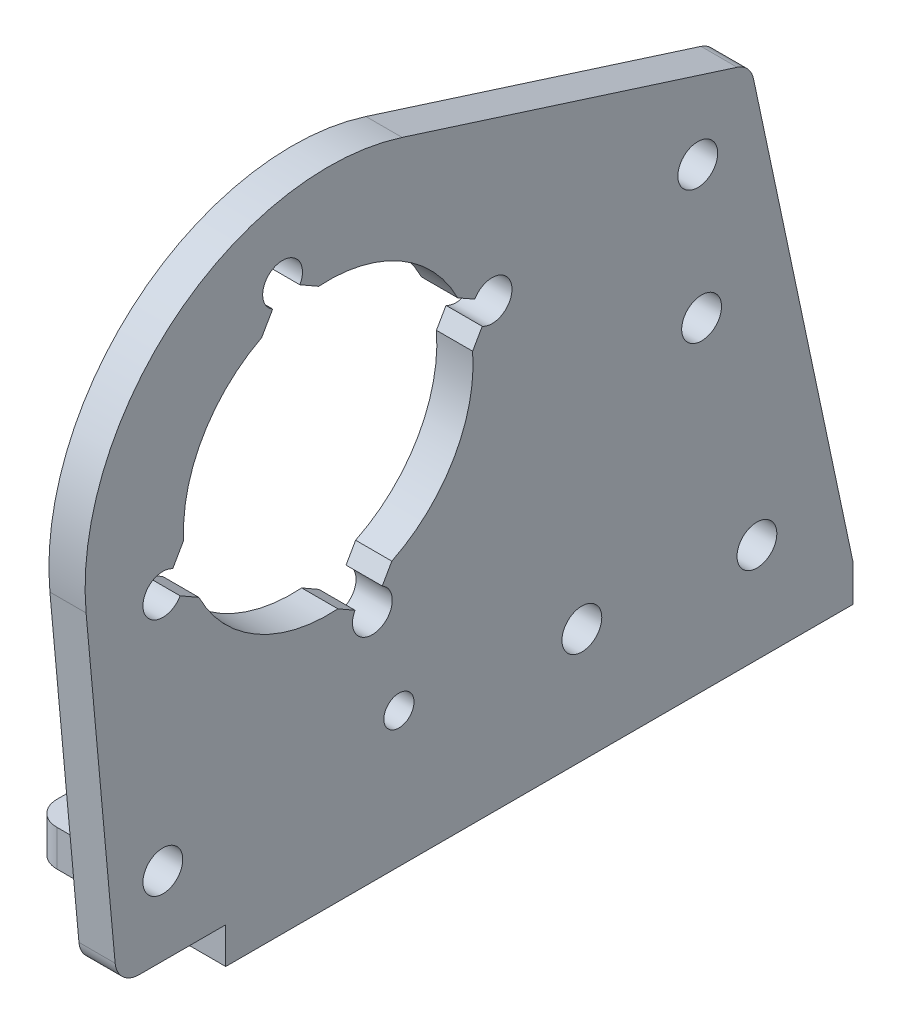
from build123d import *

# Parameters (mm, degrees)
SKETCH_1_R               = 1.65
SKETCH_1_R_2             = 1.25
EXTRUDE_4_DEPTH          = 3
SKETCH_4_W               = 52
SKETCH_4_H               = 3
EXTRUDE_6_DEPTH          = 16
CUT_EXTRUDE_1_DEPTH      = 81.034703796
CUT_EXTRUDE_1_DEPTH_BACK = 22
SKETCH_3_R               = 1.65
FILLET_1_R               = 2


with BuildPart() as part:
    # 草图1 → 凸台-拉伸4 (new body)
    with BuildSketch(Plane(origin=(0, 0, 0), x_dir=(0, 0, -1), z_dir=(1, 0, 0))):
        with BuildLine():
            Line((61, 13), (52.5, 53))
            Line((52.5, 53), (23.619851789, 62.203688194))
            ThreePointArc((23.619851789, 62.203688194), (4.878186687, 58.71413126), (-2.572313303, 41.16656538))
            Line((-2.572313303, 41.16656538), (0, 13))
            Line((0, 13), (61, 13))
        make_face()
        with BuildLine():
            Line((28.220139039, 48.391717332), (29.643651042, 47.578281902))
            ThreePointArc((29.643651042, 47.578281902), (32.668112531, 47.193796374), (30.257622978, 45.32705147))
            Line((30.257622978, 45.32705147), (29.463156964, 43.936735946))
            ThreePointArc((29.463156964, 43.936735946), (27.918719173, 37.045985315), (22.766171662, 32.217011666))
            Line((22.766171662, 32.217011666), (21.972102707, 30.827390996))
            ThreePointArc((21.972102707, 30.827390996), (21.587617178, 27.802929507), (19.720872274, 30.21341906))
            Line((19.720872274, 30.21341906), (18.298407802, 31.026255901))
            ThreePointArc((18.298407802, 31.026255901), (11.546134207, 32.58073487), (6.778813424, 37.60888126))
            Line((6.778813424, 37.60888126), (5.221211801, 38.49893933))
            ThreePointArc((5.221211801, 38.49893933), (2.196750311, 38.883424859), (4.607239865, 40.750169763))
            Line((4.607239865, 40.750169763), (5.51775044, 42.34356327))
            ThreePointArc((5.51775044, 42.34356327), (7.080883762, 48.953319836), (11.981852501, 53.655741877))
            Line((11.981852501, 53.655741877), (12.892760135, 55.249830237))
            ThreePointArc((12.892760135, 55.249830237), (13.277245664, 58.274291726), (15.143990568, 55.863802173))
            Line((15.143990568, 55.863802173), (16.702639721, 54.973145514))
            ThreePointArc((16.702639721, 54.973145514), (23.453468727, 53.418570281), (28.220139039, 48.391717332))
        make_face(mode=Mode.SUBTRACT)
        with Locations((48.441115069, 36.836873887)):
            Circle(SKETCH_1_R, mode=Mode.SUBTRACT)
        with Locations((38.518336301, 19.472011044)):
            Circle(SKETCH_1_R, mode=Mode.SUBTRACT)
        with Locations((53.026104064, 18.242284788)):
            Circle(SKETCH_1_R, mode=Mode.SUBTRACT)
        with Locations((48.125, 48)):
            Circle(SKETCH_1_R, mode=Mode.SUBTRACT)
        with Locations((3.788610616, 19.472011044)):
            Circle(SKETCH_1_R, mode=Mode.SUBTRACT)
        with Locations((23.354935737, 21.197394906)):
            Circle(SKETCH_1_R_2, mode=Mode.SUBTRACT)
    extrude(amount=EXTRUDE_4_DEPTH)

    # 草图4 → 凸台-拉伸6 (add)
    with BuildSketch(Plane(origin=(3, 0, 0), x_dir=(0, 0, -1), z_dir=(1, 0, 0))):
        with Locations((35, 11.5)):
            Rectangle(SKETCH_4_W, SKETCH_4_H)
    extrude(amount=-EXTRUDE_6_DEPTH)

    # 草图3 → 切除-拉伸1 (cut, two sides: drawn at the far end of the back side and taken through both)
    with BuildSketch(Plane(origin=(0, 13, 0), x_dir=(1, 0, 0), z_dir=(0, 1, 0)).offset(-CUT_EXTRUDE_1_DEPTH_BACK)):
        with Locations(Location((-8.6, 56.35, 0), (0, 0, 90))):
            Circle(SKETCH_3_R)
        with Locations(Location((-8.6, 47.65, 0), (0, 0, 90))):
            Circle(SKETCH_3_R)
        with Locations(Location((-8.6, 22.3, 0), (0, 0, 90))):
            Circle(SKETCH_3_R)
        with Locations(Location((-8.6, 13.6, 0), (0, 0, 90))):
            Circle(SKETCH_3_R)
    extrude(amount=CUT_EXTRUDE_1_DEPTH + CUT_EXTRUDE_1_DEPTH_BACK, mode=Mode.SUBTRACT)

    # 圆角1
    fillet_1_edges = [part.edges().sort_by_distance(p)[0] for p in [
        (1.5, 13, 0),
        (-13, 11.5, -9),
        (-13, 11.5, -61),
        (1.5, 53, -52.5),
    ]]
    fillet(fillet_1_edges, radius=FILLET_1_R)


solid = part.part
